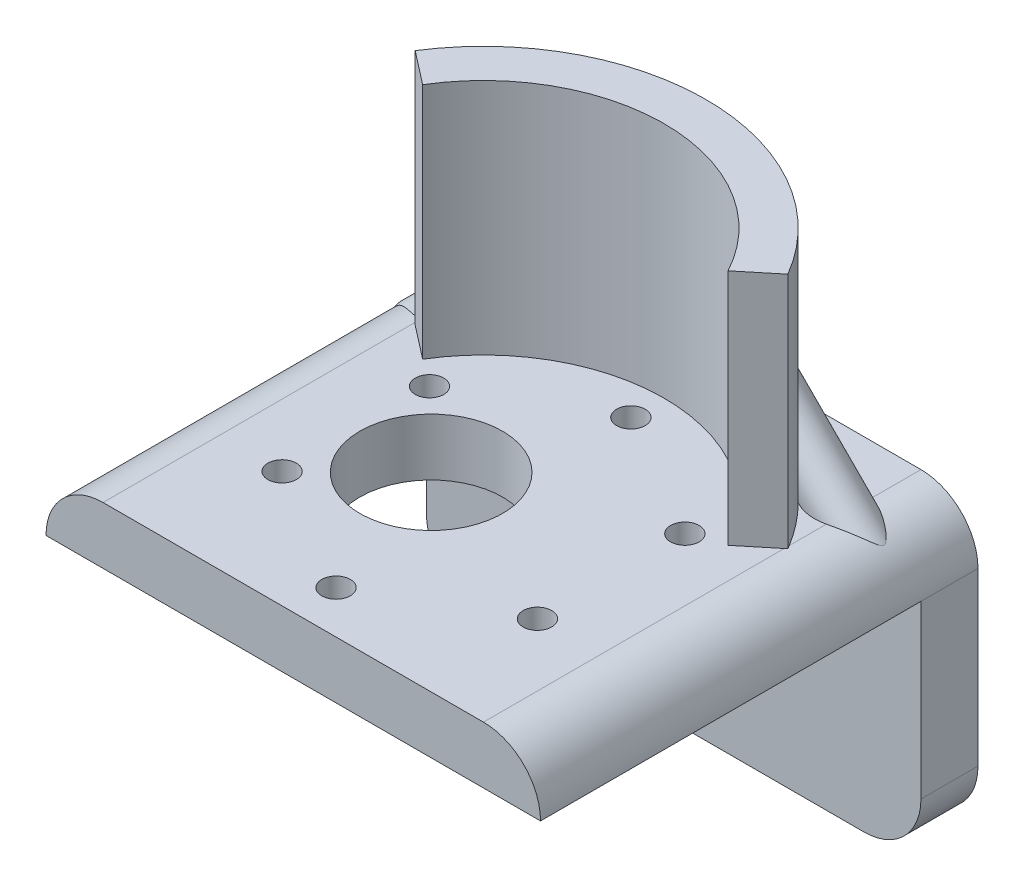
from build123d import *

# Parameters (mm, degrees)
BOSS_EXTRUDE1_DEPTH = 6
BOSS_EXTRUDE2_DEPTH = 40
CUT_EXTRUDE1_REACH  = 62.762
SKETCH9_R           = 1.5
CUT_EXTRUDE2_REACH  = 62.762
SKETCH10_R          = 7.5
BOSS_EXTRUDE4_DEPTH = 25
BOSS_EXTRUDE5_REACH = 73.576
SKETCH12_R          = 2.5
BOSS_EXTRUDE6_REACH = 73.576
SKETCH14_R          = 2.5


with BuildPart() as part:
    # Sketch3 → Boss-Extrude1 (new body)
    with BuildSketch(Plane.XY):
        with BuildLine():
            Line((-20, 10.240601504), (20, 10.240601504))
            ThreePointArc((20, 10.240601504), (24.242640687, 8.483242191), (26, 4.240601504))
            Line((26, 4.240601504), (26, -13.759398496))
            ThreePointArc((26, -13.759398496), (24.242640687, -18.002039183), (20, -19.759398496))
            Line((20, -19.759398496), (-20, -19.759398496))
            ThreePointArc((-20, -19.759398496), (-24.242640687, -18.002039183), (-26, -13.759398496))
            Line((-26, -13.759398496), (-26, 4.240601504))
            ThreePointArc((-26, 4.240601504), (-24.242640687, 8.483242191), (-20, 10.240601504))
        make_face()
    extrude(amount=BOSS_EXTRUDE1_DEPTH)

    # Sketch4 → Boss-Extrude2 (add)
    with BuildSketch(Plane.XY.offset(6)):
        with BuildLine():
            Line((-26, 4.240601504), (26, 4.240601504))
            ThreePointArc((26, 4.240601504), (24.242640687, 8.483242191), (20, 10.240601504))
            Line((20, 10.240601504), (-20, 10.240601504))
            ThreePointArc((-20, 10.240601504), (-24.242640687, 8.483242191), (-26, 4.240601504))
        make_face()
    extrude(amount=BOSS_EXTRUDE2_DEPTH)

    # Sketch9 → Cut-Extrude1 (cut, up to next)
    with BuildSketch(Plane(origin=(0, 10.240601504, 0), x_dir=(1, 0, 0), z_dir=(0, 1, 0)), mode=Mode.PRIVATE) as cut_extrude1_sk1:
        with Locations((13.423393759, -18.25)):
            Circle(SKETCH9_R)
    cut_extrude1_tool1 = extrude(cut_extrude1_sk1.sketch, amount=-CUT_EXTRUDE1_REACH, mode=Mode.PRIVATE) & part.part
    # Sketch9 → Cut-Extrude1 (cut, up to next)
    with BuildSketch(Plane(origin=(0, 10.240601504, 0), x_dir=(1, 0, 0), z_dir=(0, 1, 0)), mode=Mode.PRIVATE) as cut_extrude1_sk2:
        with Locations((0, -10.5)):
            Circle(SKETCH9_R)
    cut_extrude1_tool2 = extrude(cut_extrude1_sk2.sketch, amount=-CUT_EXTRUDE1_REACH, mode=Mode.PRIVATE) & part.part
    # Sketch9 → Cut-Extrude1 (cut, up to next)
    with BuildSketch(Plane(origin=(0, 10.240601504, 0), x_dir=(1, 0, 0), z_dir=(0, 1, 0)), mode=Mode.PRIVATE) as cut_extrude1_sk3:
        with Locations((-13.423393759, -18.25)):
            Circle(SKETCH9_R)
    cut_extrude1_tool3 = extrude(cut_extrude1_sk3.sketch, amount=-CUT_EXTRUDE1_REACH, mode=Mode.PRIVATE) & part.part
    # Sketch9 → Cut-Extrude1 (cut, up to next)
    with BuildSketch(Plane(origin=(0, 10.240601504, 0), x_dir=(1, 0, 0), z_dir=(0, 1, 0)), mode=Mode.PRIVATE) as cut_extrude1_sk4:
        with Locations((-13.423393759, -33.75)):
            Circle(SKETCH9_R)
    cut_extrude1_tool4 = extrude(cut_extrude1_sk4.sketch, amount=-CUT_EXTRUDE1_REACH, mode=Mode.PRIVATE) & part.part
    # Sketch9 → Cut-Extrude1 (cut, up to next)
    with BuildSketch(Plane(origin=(0, 10.240601504, 0), x_dir=(1, 0, 0), z_dir=(0, 1, 0)), mode=Mode.PRIVATE) as cut_extrude1_sk5:
        with Locations((0, -41.5)):
            Circle(SKETCH9_R)
    cut_extrude1_tool5 = extrude(cut_extrude1_sk5.sketch, amount=-CUT_EXTRUDE1_REACH, mode=Mode.PRIVATE) & part.part
    # Sketch9 → Cut-Extrude1 (cut, up to next)
    with BuildSketch(Plane(origin=(0, 10.240601504, 0), x_dir=(1, 0, 0), z_dir=(0, 1, 0)), mode=Mode.PRIVATE) as cut_extrude1_sk6:
        with Locations((13.423393759, -33.75)):
            Circle(SKETCH9_R)
    cut_extrude1_tool6 = extrude(cut_extrude1_sk6.sketch, amount=-CUT_EXTRUDE1_REACH, mode=Mode.PRIVATE) & part.part
    add(cut_extrude1_tool1.solids().sort_by_distance((13.423394, 10.240602, 18.25))[0], mode=Mode.SUBTRACT)
    add(cut_extrude1_tool2.solids().sort_by_distance((0, 10.240602, 10.5))[0], mode=Mode.SUBTRACT)
    add(cut_extrude1_tool3.solids().sort_by_distance((-13.423394, 10.240602, 18.25))[0], mode=Mode.SUBTRACT)
    add(cut_extrude1_tool4.solids().sort_by_distance((-13.423394, 10.240602, 33.75))[0], mode=Mode.SUBTRACT)
    add(cut_extrude1_tool5.solids().sort_by_distance((0, 10.240602, 41.5))[0], mode=Mode.SUBTRACT)
    add(cut_extrude1_tool6.solids().sort_by_distance((13.423394, 10.240602, 33.75))[0], mode=Mode.SUBTRACT)

    # Sketch10 → Cut-Extrude2 (cut, up to next)
    with BuildSketch(Plane(origin=(0, 10.240601504, 0), x_dir=(1, 0, 0), z_dir=(0, 1, 0)), mode=Mode.PRIVATE) as cut_extrude2_sk1:
        with Locations((-5.5, -26)):
            Circle(SKETCH10_R)
    cut_extrude2_tool1 = extrude(cut_extrude2_sk1.sketch, amount=-CUT_EXTRUDE2_REACH, mode=Mode.PRIVATE) & part.part
    add(cut_extrude2_tool1.solids().sort_by_distance((-5.5, 10.240602, 26))[0], mode=Mode.SUBTRACT)

    # Sketch11 → Boss-Extrude4 (add)
    with BuildSketch(Plane(origin=(0, 10.240601504, 0), x_dir=(1, 0, 0), z_dir=(0, 1, 0))):
        with BuildLine():
            Line((16.755404651, -17.041405524), (20.209569094, -14.204521331))
            ThreePointArc((20.209569094, -14.204521331), (0.448372053, -2.604296067), (-19.742781111, -13.438845833))
            Line((-19.742781111, -13.438845833), (-16.246095761, -16.147874721))
            ThreePointArc((-16.246095761, -16.147874721), (0.514245282, -7.006960438), (16.755404651, -17.041405524))
        make_face()
    extrude(amount=BOSS_EXTRUDE4_DEPTH)

    # Sketch12 → Boss-Extrude5 (add, up to next)
    with BuildSketch(Plane(origin=(7.879699248, -7.879699248, 0), x_dir=(0, 0, 1), z_dir=(-0.7071067811865489, 0.7071067811865462, 0)), mode=Mode.PRIVATE) as boss_extrude5_sk1:
        with Locations((7.574761701, 20.594839086)):
            Circle(SKETCH12_R)
    boss_extrude5_tool1 = extrude(boss_extrude5_sk1.sketch, amount=BOSS_EXTRUDE5_REACH, mode=Mode.PRIVATE) - part.part
    add(boss_extrude5_tool1.solids().sort_by_distance((22.44245, 6.683051, 7.574762))[0])

    # Sketch14 → Boss-Extrude6 (add, up to next)
    with BuildSketch(Plane(origin=(-7.879699248, -7.879699248, 0), x_dir=(0, 0, -1), z_dir=(0.7071067811865487, 0.7071067811865465, 0)), mode=Mode.PRIVATE) as boss_extrude6_sk1:
        with Locations((-10.283332747, 20.780524406)):
            Circle(SKETCH14_R)
    boss_extrude6_tool1 = extrude(boss_extrude6_sk1.sketch, amount=BOSS_EXTRUDE6_REACH, mode=Mode.PRIVATE) - part.part
    add(boss_extrude6_tool1.solids().sort_by_distance((-22.573749, 6.81435, 10.283333))[0])


solid = part.part
